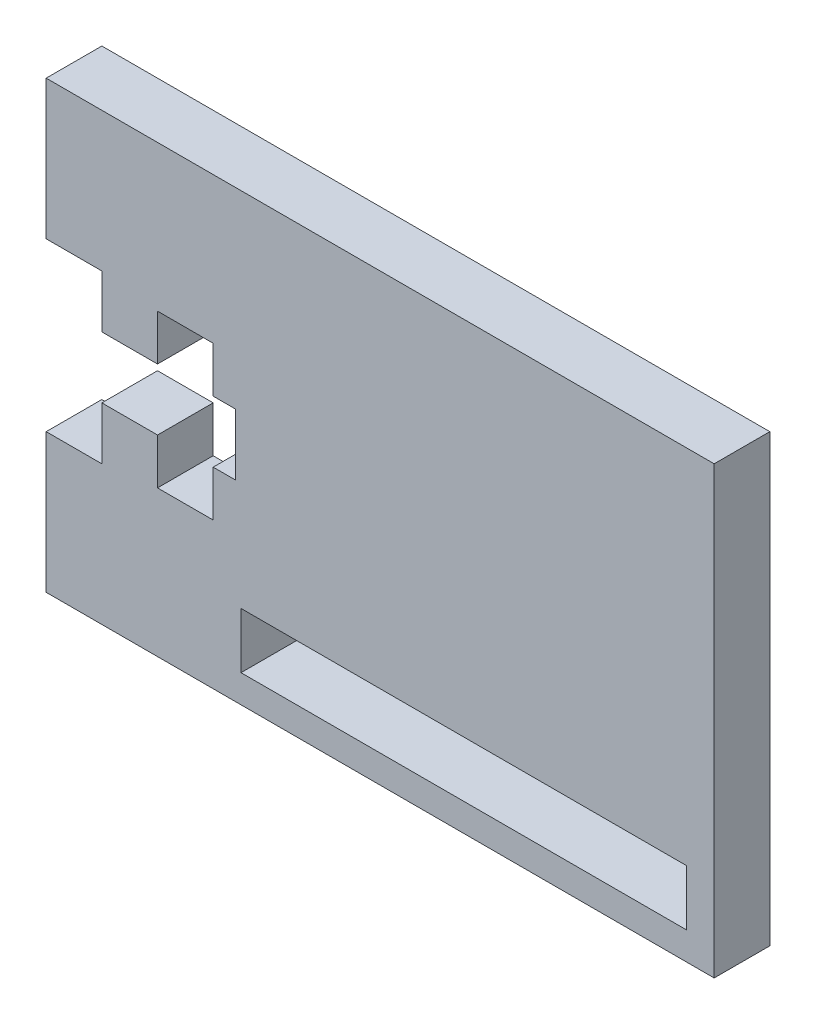
from build123d import *

# Parameters (mm, degrees)
SKETCH2_W           = 25.4
SKETCH2_H           = 3.175
BOSS_EXTRUDE1_DEPTH = 3.175


with BuildPart() as part:
    # Sketch2 → Boss-Extrude1 (new body)
    with BuildSketch(Plane.XY):
        Polygon((0, 7.9375), (0, 0), (38.1, 0), (38.1, 25.4), (0, 25.4), (0, 17.4625), (3.175, 17.4625), (3.175, 14.4526), (6.35, 14.4526), (6.35, 17.065625), (9.525, 17.065625), (9.525, 14.4526), (10.795, 14.4526), (10.795, 10.9474), (9.525, 10.9474), (9.525, 8.334375), (6.35, 8.334375), (6.35, 10.9474), (3.175, 10.9474), (3.175, 7.9375), align=None)
        with Locations((23.8125, 3.175)):
            Rectangle(SKETCH2_W, SKETCH2_H, mode=Mode.SUBTRACT)
    extrude(amount=BOSS_EXTRUDE1_DEPTH)


solid = part.part
